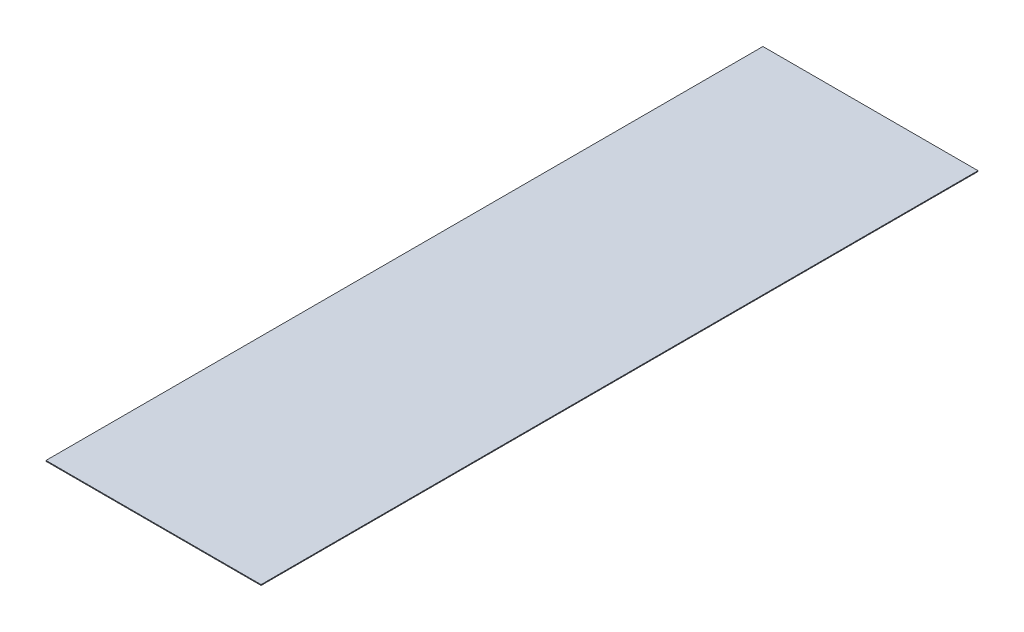
from build123d import *

# Parameters (mm, degrees)
CROQUIS1_W              = 914.4
CROQUIS1_H              = 3048
SALIENTE_EXTRUIR1_DEPTH = 3.4


with BuildPart() as part:
    # Croquis1 → Saliente-Extruir1 (new body)
    with BuildSketch(Plane(origin=(0, 0, 0), x_dir=(1, 0, 0), z_dir=(0, 1, 0))):
        Rectangle(CROQUIS1_W, CROQUIS1_H)
    extrude(amount=SALIENTE_EXTRUIR1_DEPTH)


solid = part.part
